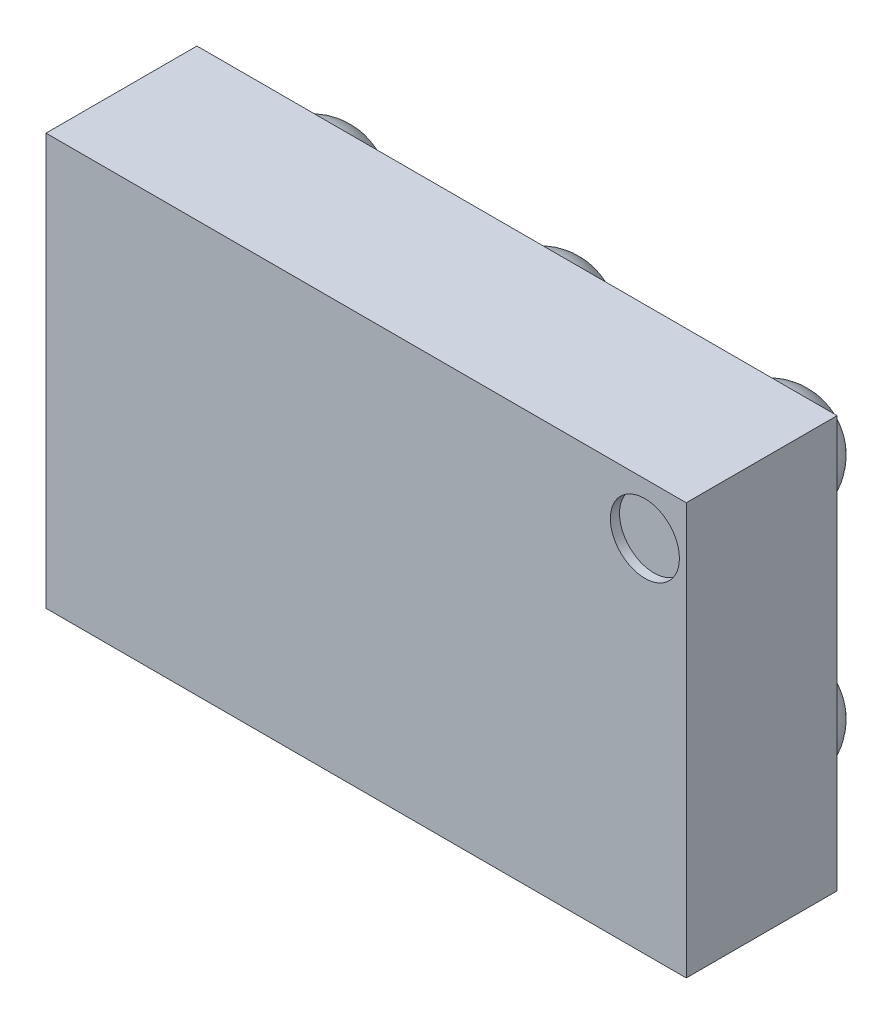
from build123d import *

# Parameters (mm, degrees)
BOSS_EXTRUDE1_START  = 0.17
SKETCH1_W            = 1.4
SKETCH1_H            = 0.9
BOSS_EXTRUDE1_DEPTH  = 0.33
LPATTERN1_COUNT      = 3
LPATTERN1_PITCH      = 0.5
LPATTERN1_COUNT_DIR2 = 2
LPATTERN1_PITCH_DIR2 = 0.5
SKETCH3_R            = 0.075498707
CUT_EXTRUDE1_DEPTH   = 0.02


with BuildPart() as part:
    # Sketch1 → Boss-Extrude1 (new body)
    with BuildSketch(Plane.XY.offset(BOSS_EXTRUDE1_START)):
        Rectangle(SKETCH1_W, SKETCH1_H)
    extrude(amount=BOSS_EXTRUDE1_DEPTH)

    # Sketch2 → Revolve1 (revolve)
    with BuildSketch(Plane(origin=(0, 0.25, 0), x_dir=(1, 0, 0), z_dir=(0, 1, 0))):
        with BuildLine():
            Line((-0.5, 0), (-0.5, -0.24))
            ThreePointArc((-0.5, -0.24), (-0.62, -0.12), (-0.5, 0))
        make_face()
    revolve1 = revolve(axis=Axis((-0.5, 0.25, 0), (0, 0, 1)))

    # LPattern1: Revolve1 3 × 2
    with Locations(*[(i * LPATTERN1_PITCH, -j * LPATTERN1_PITCH_DIR2, 0) for i in range(LPATTERN1_COUNT) for j in range(LPATTERN1_COUNT_DIR2) if (i, j) != (0, 0)]):
        add(revolve1)

    # Sketch3 → Cut-Extrude1 (cut)
    with BuildSketch(Plane.XY.offset(0.5)):
        with Locations((0.609536705, 0.337163061)):
            Circle(SKETCH3_R)
    extrude(amount=-CUT_EXTRUDE1_DEPTH, mode=Mode.SUBTRACT)


solid = part.part
